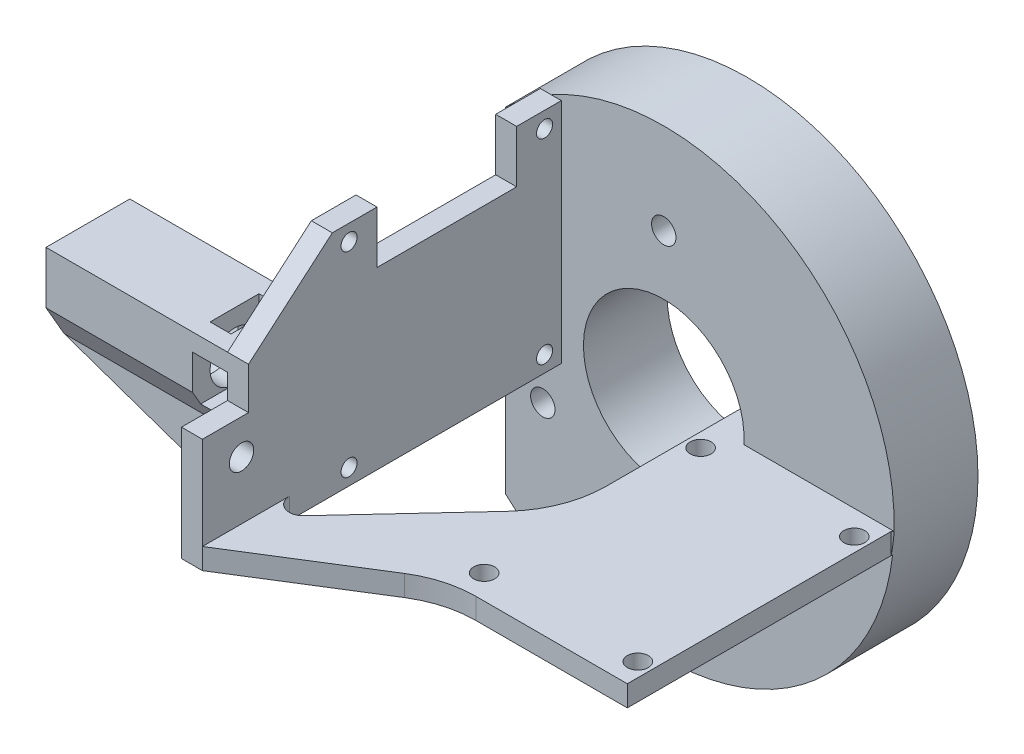
from build123d import *

# Parameters (mm, degrees)
SKETCH_1_R           = 29
EXTRUDE_1_DEPTH      = 5
HOLE_WIZARD_1_D      = 3.5
HOLE_WIZARD_2_D      = 23
EXTRUDE_3_DEPTH      = 65
SKETCH_9_W           = 1
SKETCH_9_H           = 5
CUT_EXTRUDE_1_DEPTH  = 10
SKETCH_10_W          = 3
SKETCH_10_H          = 65
EXTRUDE_5_DEPTH      = 10
HOLE_WIZARD_3_D      = 3.5
EXTRUDE_START        = -65
EXTRUDE_6_DEPTH      = 65
SKETCH_22_W          = 12
SKETCH_22_H          = 6
EXTRUDE_7_DEPTH      = 3
EXTRUDE_8_DEPTH      = 8
HOLE_WIZARD_5_D      = 7
HOLE_WIZARD_5_DEPTH  = 3
SKETCH_27_W          = 5
SKETCH_27_H          = 3.5
CUT_EXTRUDE_3_DEPTH  = 70.598725899
CUT_EXTRUDE_4_REACH  = 94.289
SKETCH_28_W          = 3
SKETCH_28_H          = 3.5
SKETCH_29_R          = 3.5
EXTRUDE_9_DEPTH      = 18
HOLE_WIZARD_6_D      = 10.2
HOLE_WIZARD_6_DEPTH  = 18
SKETCH_32_W          = 26
SKETCH_32_H          = 5
EXTRUDE_10_DEPTH     = 9
CUT_EXTRUDE_5_REACH  = 88.897
SKETCH_36_W          = 32.8
SKETCH_36_H          = 32.6
EXTRUDE_12_DEPTH     = 3
SKETCH_38_R          = 29
CUT_EXTRUDE_7_DEPTH  = 5
SKETCH_39_W          = 17.667068266
SKETCH_39_H          = 15
CUT_EXTRUDE_8_DEPTH  = 13.6
SKETCH_41_R          = 33
EXTRUDE_14_DEPTH     = 12
HOLE_WIZARD_8_D      = 3.5
HOLE_WIZARD_9_D      = 23
HOLE_WIZARD_10_D     = 2.3
SKETCH_53_W          = 20
SKETCH_53_H          = 15
CUT_EXTRUDE_9_DEPTH  = 3
EXTRUDE_16_DEPTH     = 3
SKETCH_56_W          = 3.442096105
SKETCH_56_H          = 51.4
CUT_EXTRUDE_10_DEPTH = 96.777795528
SKETCH_57_W          = 3
SKETCH_57_H          = 1.3
EXTRUDE_17_DEPTH     = 18.6
EXTRUDE_18_DEPTH     = 3
CUT_EXTRUDE_START    = -12
CUT_EXTRUDE_11_DEPTH = 12
SKETCH_63_W          = 26
SKETCH_63_H          = 3
EXTRUDE_21_DEPTH     = 38
HOLE_WIZARD_11_D     = 3
EXTRUDE_22_DEPTH     = 3
CUT_EXTRUDE_START_2  = 4
CUT_EXTRUDE_13_DEPTH = 4
FILLET_1_R           = 15
FILLET_2_R           = 2
EXTRUDE_23_DEPTH     = 12


with BuildPart() as part:
    # 草图1 → 凸台-拉伸1 (new body)
    with BuildSketch(Plane.XY):
        Circle(SKETCH_1_R)
    extrude(amount=EXTRUDE_1_DEPTH)

    # 孔1 (through all)
    with Locations(Plane.XY.offset(5)):
        with Locations((0, 20), (-17.320508076, -10), (17.320508076, -10)):
            Hole(HOLE_WIZARD_1_D / 2)

    # 孔2 (through all)
    with Locations(Plane.XY.offset(5)):
        with Locations((0, 0)):
            Hole(HOLE_WIZARD_2_D / 2)

    # 草图7 → 凸台-拉伸3 (add)
    with BuildSketch(Plane.XY.offset(5)):
        with BuildLine():
            Line((-28.892040426, 2.5), (-28.892040426, -2.5))
            Line((-28.892040426, -2.5), (-11.22497216, -2.5))
            ThreePointArc((-11.22497216, -2.5), (-11.5, 0), (-11.22497216, 2.5))
            Line((-11.22497216, 2.5), (-28.892040426, 2.5))
        make_face()
    extrude(amount=EXTRUDE_3_DEPTH)

    # 草图9 → 切除-拉伸1 (cut)
    with BuildSketch(Plane.XY.offset(5)):
        with Locations((-29.392040426, 0)):
            Rectangle(SKETCH_9_W, SKETCH_9_H)
    extrude(amount=-CUT_EXTRUDE_1_DEPTH, mode=Mode.SUBTRACT)

    # 草图10 → 凸台-拉伸5 (add)
    with BuildSketch(Plane(origin=(0, 2.5, 0), x_dir=(1, 0, 0), z_dir=(0, 1, 0))):
        with Locations((-27.392040426, -37.5)):
            Rectangle(SKETCH_10_W, SKETCH_10_H)
    extrude(amount=EXTRUDE_5_DEPTH)

    # 孔3 (through all)
    with Locations(Plane.ZY.offset(28.892040426)):
        with Locations((10, 7.5), (64.4, 7.5)):
            Hole(HOLE_WIZARD_3_D / 2)

    # 草图20 → 凸台-拉伸6 (add)
    with BuildSketch(Plane.XY.offset(70).offset(EXTRUDE_START)):
        with BuildLine():
            Line((-11.22497216, 2.5), (-11.22497216, -2.5))
            ThreePointArc((-11.22497216, -2.5), (-11.5, 0), (-11.22497216, 2.5))
        make_face()
    extrude(amount=EXTRUDE_6_DEPTH)

    # 草图22 → 凸台-拉伸7 (add)
    with BuildSketch(Plane.ZY.offset(28.892040426)):
        with Locations((57.4, 15.5)):
            Rectangle(SKETCH_22_W, SKETCH_22_H)
    extrude(amount=-EXTRUDE_7_DEPTH)

    # 草图23 → 凸台-拉伸8 (add)
    with BuildSketch(Plane.ZY.offset(28.892040426)):
        Polygon((51.4, 6.5), (60.801923789, 6.5), (63.4, 11), (63.4, 12.5), (63.4, 18.5), (51.4, 18.5), (51.4, 12.5), align=None)
    extrude(amount=EXTRUDE_8_DEPTH)

    # 孔5
    with Locations(Plane.ZY.offset(36.892040426)):
        with Locations((57.4, 12.5)):
            Hole(HOLE_WIZARD_5_D / 2, depth=HOLE_WIZARD_5_DEPTH)

    # 草图27 → 切除-拉伸3 (cut, through all)
    with BuildSketch(Plane(origin=(0, 0, 51.4), x_dir=(-1, 0, 0), z_dir=(0, 0, -1))):
        with Locations((31.392040426, 14.25)):
            Rectangle(SKETCH_27_W, SKETCH_27_H)
        with Locations((31.392040426, 10.75)):
            Rectangle(SKETCH_27_W, SKETCH_27_H)
    extrude(amount=-CUT_EXTRUDE_3_DEPTH, mode=Mode.SUBTRACT)

    # 草图28 → 切除-拉伸4 (cut, up to next)
    with BuildSketch(Plane(origin=(0, 18.5, 0), x_dir=(1, 0, 0), z_dir=(0, 1, 0)), mode=Mode.PRIVATE) as cut_extrude_4_sk1:
        with Locations((-32.392040426, -59.15)):
            Rectangle(SKETCH_28_W, SKETCH_28_H)
    cut_extrude_4_tool1 = extrude(cut_extrude_4_sk1.sketch, amount=-CUT_EXTRUDE_4_REACH, mode=Mode.PRIVATE) & part.part
    # 草图28 → 切除-拉伸4 (cut, up to next)
    with BuildSketch(Plane(origin=(0, 18.5, 0), x_dir=(1, 0, 0), z_dir=(0, 1, 0)), mode=Mode.PRIVATE) as cut_extrude_4_sk2:
        with Locations((-32.392040426, -55.65)):
            Rectangle(SKETCH_28_W, SKETCH_28_H)
    cut_extrude_4_tool2 = extrude(cut_extrude_4_sk2.sketch, amount=-CUT_EXTRUDE_4_REACH, mode=Mode.PRIVATE) & part.part
    add(cut_extrude_4_tool1.solids().sort_by_distance((-32.39204, 18.5, 59.15))[0], mode=Mode.SUBTRACT)
    add(cut_extrude_4_tool2.solids().sort_by_distance((-32.39204, 18.5, 55.65))[0], mode=Mode.SUBTRACT)

    # 草图29 → 凸台-拉伸9 (add)
    # profile 1 of 2: a face of its own
    with BuildSketch(Plane.ZY.offset(36.892040426)):
        Polygon((60.801923789, 6.5), (63.4, 11), (63.4, 18.5), (51.4, 18.5), (51.4, 6.5), align=None)
        with Locations((57.4, 12.5)):
            Circle(SKETCH_29_R, mode=Mode.SUBTRACT)
    # profile 2 of 2: a face of its own
    with BuildSketch(Plane.ZY.offset(36.892040426)):
        with Locations((57.4, 12.5)):
            Circle(SKETCH_29_R)
    extrude(amount=EXTRUDE_9_DEPTH)

    # 孔6
    with Locations(Plane.ZY.offset(54.892040426)):
        with Locations((57.4, 12.5)):
            Hole(HOLE_WIZARD_6_D / 2, depth=HOLE_WIZARD_6_DEPTH)

    # 草图32 → 凸台-拉伸10 (add)
    with BuildSketch(Plane.XZ.offset(-6.5)):
        with Locations((-41.892040426, 58.301923789)):
            Rectangle(SKETCH_32_W, SKETCH_32_H)
    extrude(amount=EXTRUDE_10_DEPTH)

    # 草图33 → 切除-拉伸5 (cut, up to next)
    with BuildSketch(Plane.XY.offset(60.801923789), mode=Mode.PRIVATE) as cut_extrude_5_sk1:
        Polygon((-54.892040426, 6.5), (-28.892040426, -2.5), (-54.892040426, -2.5), align=None)
    cut_extrude_5_tool1 = extrude(cut_extrude_5_sk1.sketch, amount=-CUT_EXTRUDE_5_REACH, mode=Mode.PRIVATE) & part.part
    add(cut_extrude_5_tool1.solids().sort_by_distance((-46.225374, 0.5, 60.801924))[0], mode=Mode.SUBTRACT)

    # 草图36 → 凸台-拉伸12 (add)
    with BuildSketch(Plane.ZY.offset(28.892040426)):
        with Locations((35, 12.5)):
            Rectangle(SKETCH_36_W, SKETCH_36_H)
    extrude(amount=-EXTRUDE_12_DEPTH)

    # 草图38 → 切除-拉伸7 (cut)
    with BuildSketch(Plane(origin=(0, 0, 0), x_dir=(-1, 0, 0), z_dir=(0, 0, -1))):
        Circle(SKETCH_38_R)
    extrude(amount=-CUT_EXTRUDE_7_DEPTH, mode=Mode.SUBTRACT)

    # 草图39 → 切除-拉伸8 (cut)
    with BuildSketch(Plane(origin=(0, 0, 5), x_dir=(-1, 0, 0), z_dir=(0, 0, -1))):
        with Locations((20.058506293, 5)):
            Rectangle(SKETCH_39_W, SKETCH_39_H)
    extrude(amount=-CUT_EXTRUDE_8_DEPTH, mode=Mode.SUBTRACT)

    # 草图41 → 凸台-拉伸14 (add)
    with BuildSketch(Plane(origin=(0, 0, 18.6), x_dir=(-1, 0, 0), z_dir=(0, 0, -1))):
        with Locations(Location((11.22497216, 0, 0), (0, 0, 57.631283974))):
            Circle(SKETCH_41_R)
    extrude(amount=EXTRUDE_14_DEPTH)

    # 孔8 (through all)
    with Locations(Plane(origin=(0, 0, 6.6), x_dir=(-1, 0, 0), z_dir=(0, 0, -1))):
        with Locations((11.22497216, 20), (-6.095535915, -10), (28.545480236, -10)):
            Hole(HOLE_WIZARD_8_D / 2)

    # 孔9 (through all)
    with Locations(Plane(origin=(0, 0, 6.6), x_dir=(-1, 0, 0), z_dir=(0, 0, -1))):
        with Locations((11.22497216, 0)):
            Hole(HOLE_WIZARD_9_D / 2)

    # 孔10 (through all)
    with Locations(Plane.ZY.offset(28.892040426)):
        with Locations((21, 26.5), (49, 26.5), (49, -1.5), (21, -1.5)):
            Hole(HOLE_WIZARD_10_D / 2)

    # 草图53 → 切除-拉伸9 (cut)
    with BuildSketch(Plane.ZY.offset(28.892040426)):
        with Locations((35, 28.8)):
            Rectangle(SKETCH_53_W, SKETCH_53_H)
    extrude(amount=-CUT_EXTRUDE_9_DEPTH, mode=Mode.SUBTRACT)

    # 草图55 → 凸台-拉伸16 (add)
    with BuildSketch(Plane(origin=(-25.892040426, 0, 0), x_dir=(0, 0, -1), z_dir=(1, 0, 0))):
        Polygon((-51.4, 28.8), (-63.4, 18.5), (-51.4, 18.5), align=None)
    extrude(amount=-EXTRUDE_16_DEPTH)

    # 草图56 → 切除-拉伸10 (cut, through all)
    with BuildSketch(Plane(origin=(0, 2.5, 0), x_dir=(1, 0, 0), z_dir=(0, 1, 0))):
        with Locations((-24.170992373, -44.3)):
            Rectangle(SKETCH_56_W, SKETCH_56_H)
    extrude(amount=-CUT_EXTRUDE_10_DEPTH, mode=Mode.SUBTRACT)

    # 草图57 → 凸台-拉伸17 (add)
    with BuildSketch(Plane.XY.offset(51.4)):
        with Locations((-27.392040426, -3.15)):
            Rectangle(SKETCH_57_W, SKETCH_57_H)
    extrude(amount=EXTRUDE_17_DEPTH)

    # 草图58 → 凸台-拉伸18 (add)
    with BuildSketch(Plane.XZ.offset(3.8)):
        Polygon((-25.892040426, 70), (21.77502784, 18.6), (14.955892727, 18.6), (-25.892040426, 62.646840732), align=None)
    extrude(amount=-EXTRUDE_18_DEPTH)

    # 草图62 → 切除-拉伸11 (cut)
    with BuildSketch(Plane(origin=(0, 0, 6.6), x_dir=(-1, 0, 0), z_dir=(0, 0, -1)).offset(CUT_EXTRUDE_START)):
        Polygon((33.892040426, 193.306123394), (33.892040426, 23.983411272), (33.892040426, -23.983411272), (33.892040426, -193.306123394), (372.537464671, -193.306123394), (372.537464671, 193.306123394), align=None)
    extrude(amount=CUT_EXTRUDE_11_DEPTH, mode=Mode.SUBTRACT)

    # 草图63 → 凸台-拉伸21 (add)
    with BuildSketch(Plane.XY.offset(18.6)):
        with Locations((8.555509837, -2.3)):
            Rectangle(SKETCH_63_W, SKETCH_63_H)
    extrude(amount=EXTRUDE_21_DEPTH)

    # 孔11 (through all)
    with Locations(Plane(origin=(0, -0.8, 0), x_dir=(1, 0, 0), z_dir=(0, 1, 0))):
        with Locations((-2.444490163, -22.1), (19.555509837, -22.1), (-2.444490163, -53.1), (19.555509837, -53.1)):
            Hole(HOLE_WIZARD_11_D / 2)

    # 草图67 → 凸台-拉伸22 (add)
    with BuildSketch(Plane(origin=(0, -0.8, 0), x_dir=(1, 0, 0), z_dir=(0, 1, 0))):
        Polygon((-25.892040426, -70), (-4.444490163, -56.6), (-4.444490163, -46.872836454), align=None)
    extrude(amount=-EXTRUDE_22_DEPTH)

    # 草图68 → 切除-拉伸13 (cut)
    with BuildSketch(Plane.XY.offset(18.6).offset(CUT_EXTRUDE_START_2)):
        with BuildLine():
            ThreePointArc((21.555509837, -3.8), (21.498484695, -4.263258313), (21.434913054, -4.725663739))
            Line((21.434913054, -4.725663739), (29.536238519, -6.781789189))
            ThreePointArc((29.536238519, -6.781789189), (29.956240846, -3.402448529), (30.096559281, 0))
            ThreePointArc((30.096559281, 0), (30.084776458, 0.986726755), (30.049434711, 1.972890781))
            Line((30.049434711, 1.972890781), (21.716000836, 1.972890781))
            ThreePointArc((21.716000836, 1.972890781), (21.760267788, 0.9868868), (21.77502784, 0))
            ThreePointArc((21.77502784, 0), (21.772603152, -0.400029392), (21.765329445, -0.8))
            ThreePointArc((21.765329445, -0.8), (21.694611585, -2.30239138), (21.555509837, -3.8))
        make_face()
    extrude(amount=-CUT_EXTRUDE_13_DEPTH, mode=Mode.SUBTRACT)

    # 圆角1
    fillet_1_edges = [part.edges().sort_by_distance(p)[0] for p in [
        (-4.444490163, -2.3, 56.6),
        (-4.444490163, -2.3, 39.519677186),
    ]]
    fillet(fillet_1_edges, radius=FILLET_1_R)

    # 圆角2
    fillet_2_edges = [part.edges().sort_by_distance(p)[0] for p in [
        (-25.892040426, -2.3, 62.646840732),
    ]]
    fillet(fillet_2_edges, radius=FILLET_2_R)

    # 草图69 → 凸台-拉伸23 (add)
    with BuildSketch(Plane(origin=(0, 0, 18.6), x_dir=(-1, 0, 0), z_dir=(0, 0, -1))):
        with BuildLine():
            Line((4.444490163, -3.8), (4.444490163, -0.8))
            Line((4.444490163, -0.8), (-0.247168006, -0.8))
            ThreePointArc((-0.247168006, -0.8), (-0.038441417, -2.320671148), (0.370940651, -3.8))
            Line((0.370940651, -3.8), (4.444490163, -3.8))
        make_face()
    extrude(amount=EXTRUDE_23_DEPTH)


solid = part.part
